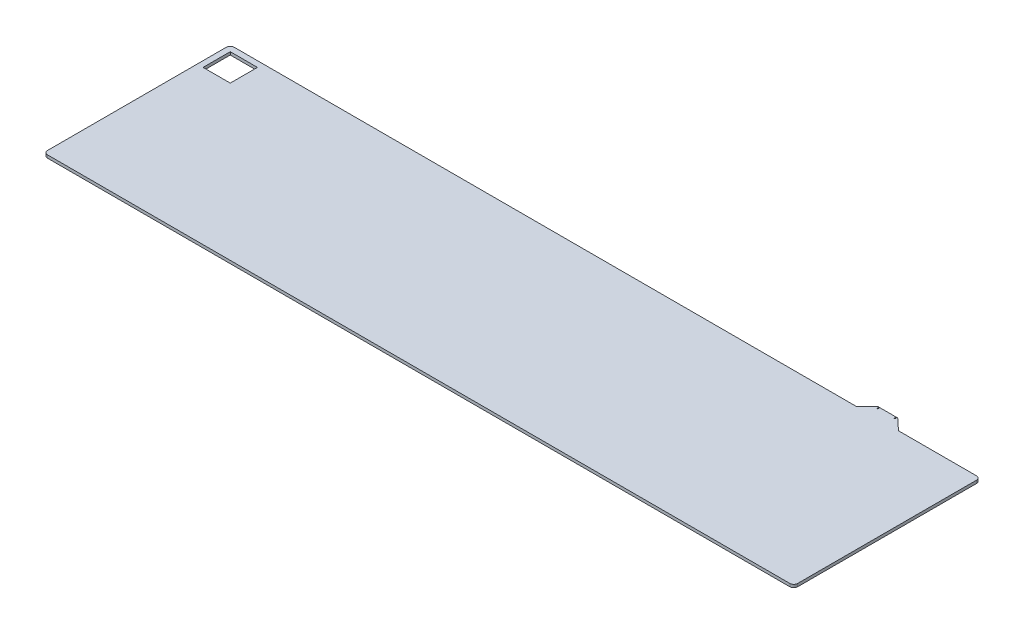
from build123d import *

# Parameters (mm, degrees)
BOSS_EXTRUDE1_DEPTH = 1.5
BOSS_EXTRUDE2_DEPTH = 1.5
SKETCH3_W           = 0.5
SKETCH3_H           = 0.8
CUT_EXTRUDE1_DEPTH  = 400.124667241
SKETCH4_W           = 365.290263007
SKETCH4_H           = 79.626519776
BOSS_EXTRUDE3_DEPTH = 1.6
SKETCH5_W           = 14
SKETCH5_H           = 14
CUT_EXTRUDE2_DEPTH  = 400.133887311


with BuildPart() as part:
    # Sketch1 → Boss-Extrude1 (new body)
    with BuildSketch(Plane(origin=(0, 0, 0), x_dir=(1, 0, 0), z_dir=(0, 1, 0))):
        with BuildLine():
            Line((2, 0), (384, 0))
            ThreePointArc((384, 0), (385.414213562, 0.585786438), (386, 2))
            Line((386, 2), (386, 94))
            ThreePointArc((386, 94), (385.414213562, 95.414213562), (384, 96))
            Line((384, 96), (2, 96))
            ThreePointArc((2, 96), (0.585786438, 95.414213562), (0, 94))
            Line((0, 94), (0, 2))
            ThreePointArc((0, 2), (0.585786438, 0.585786438), (2, 0))
        make_face()
    extrude(amount=BOSS_EXTRUDE1_DEPTH)

    # Sketch2 → Boss-Extrude2 (add)
    with BuildSketch(Plane(origin=(0, 1.5, 0), x_dir=(1, 0, 0), z_dir=(0, 1, 0))):
        Polygon((343.8928, 96), (338, 101.5), (328, 101.5), (322.1072, 96), align=None)
    extrude(amount=-BOSS_EXTRUDE2_DEPTH)

    # Sketch3 → Cut-Extrude1 (cut, through all)
    with BuildSketch(Plane(origin=(0, 1.5, 0), x_dir=(1, 0, 0), z_dir=(0, 1, 0))):
        with Locations((328.57, 100.85)):
            Rectangle(SKETCH3_W, SKETCH3_H)
        with Locations((337.43, 100.85)):
            Rectangle(SKETCH3_W, SKETCH3_H)
    extrude(amount=-CUT_EXTRUDE1_DEPTH, mode=Mode.SUBTRACT)

    # Sketch4 → Boss-Extrude3 (add)
    with BuildSketch(Plane.XZ):
        with Locations((192.889995692, -46.221612613)):
            Rectangle(SKETCH4_W, SKETCH4_H)
    extrude(amount=BOSS_EXTRUDE3_DEPTH)

    # Sketch5 → Cut-Extrude2 (cut, through all)
    with BuildSketch(Plane(origin=(0, 1.5, 0), x_dir=(1, 0, 0), z_dir=(0, 1, 0))):
        with Locations((10, 86)):
            Rectangle(SKETCH5_W, SKETCH5_H)
    extrude(amount=-CUT_EXTRUDE2_DEPTH, mode=Mode.SUBTRACT)


solid = part.part
